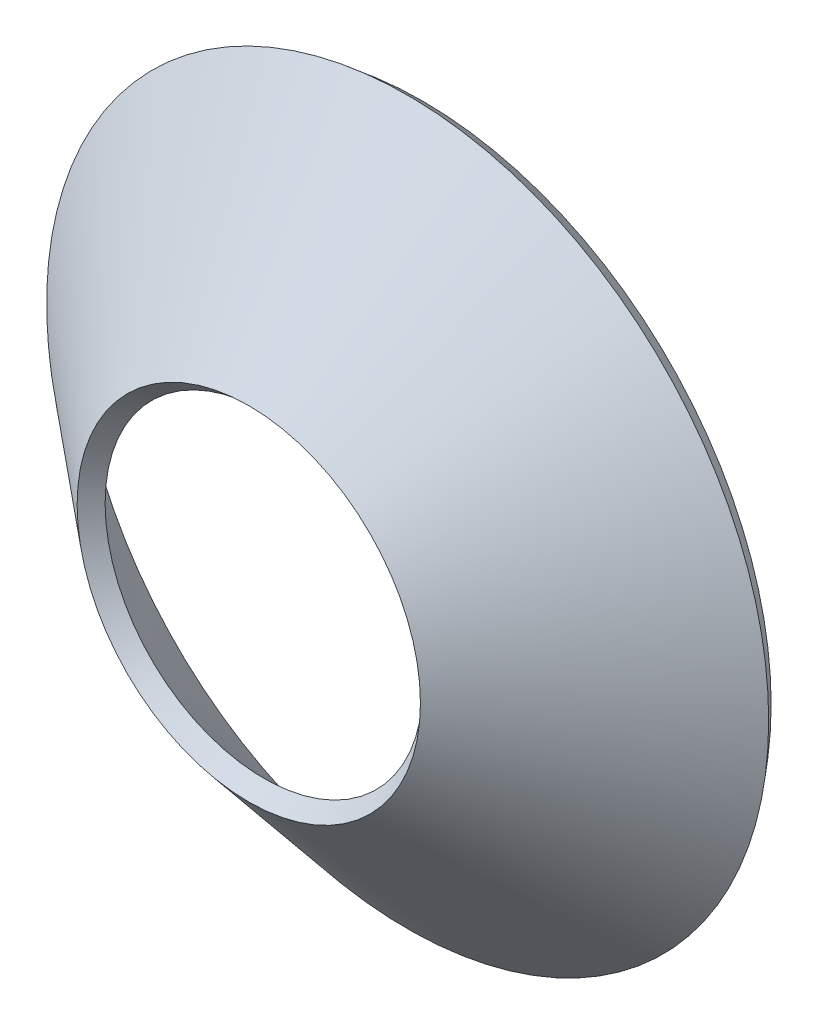
from build123d import *


with BuildPart() as part:
    # Sketch1 → Revolve-Thin1 (revolve)
    with BuildSketch(Plane.YZ, mode=Mode.PRIVATE) as revolve_thin1_sk:
        Polygon((25.4, 25.4), (55.670541252, 0), (57.711391913, 2.432191107), (27.440850661, 27.832191107), align=None)
    revolve(revolve_thin1_sk.sketch.rotate(Axis((0, 0, 26.67), (0, 0, -1)), 90), axis=Axis((0, 0, 26.67), (0, 0, -1)))


solid = part.part
